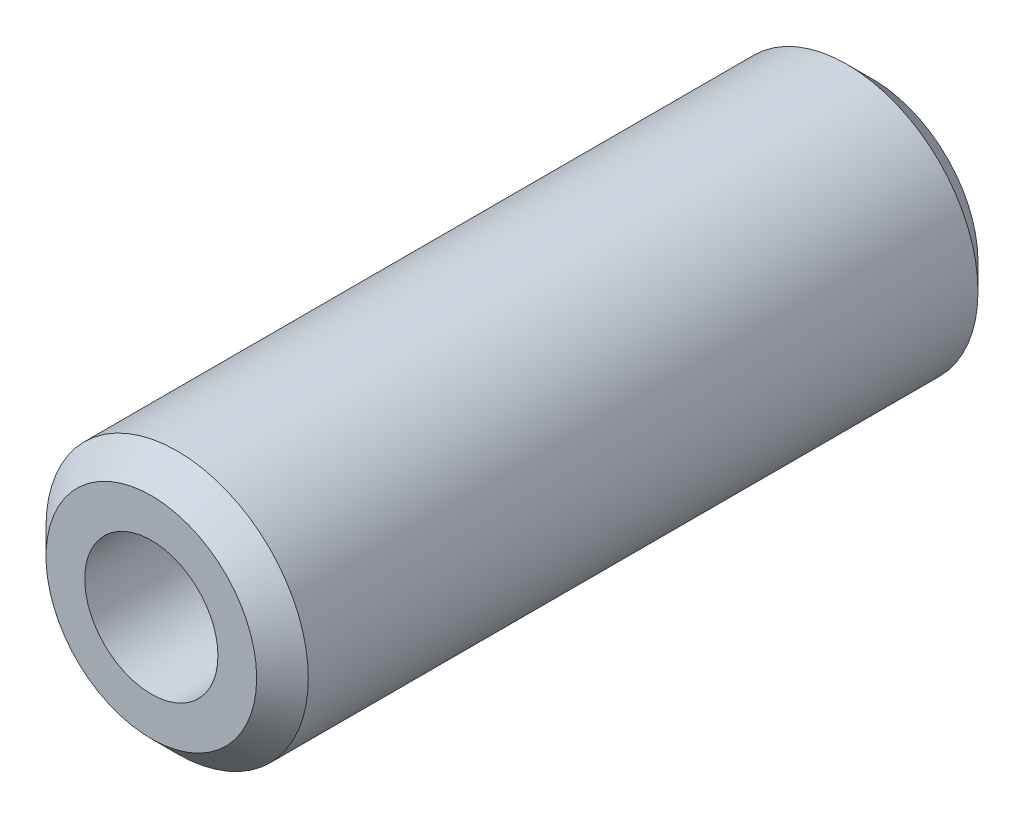
from build123d import *

# Parameters (mm, degrees)
SKETCH1_R               = 12.7
BOSS_EXTRUDE1_DEPTH     = 69.85
CUT_EXTRUDE1_DEPTH      = 73.122135992
CUT_EXTRUDE1_DEPTH_BACK = 73.122135992
SKETCH2_R               = 6.45
CHAMFER1_SIZE           = 2.5


with BuildPart() as part:
    # Sketch1 → Boss-Extrude1 (new body)
    with BuildSketch(Plane.XY):
        Circle(SKETCH1_R)
    extrude(amount=BOSS_EXTRUDE1_DEPTH)

    # Sketch2 → Cut-Extrude1 (cut, two sides: drawn at the far end of the back side and taken through both)
    with BuildSketch(Plane.XY.offset(69.85).offset(-CUT_EXTRUDE1_DEPTH_BACK)):
        Circle(SKETCH2_R)
    extrude(amount=CUT_EXTRUDE1_DEPTH + CUT_EXTRUDE1_DEPTH_BACK, mode=Mode.SUBTRACT)

    # Chamfer1
    chamfer1_edges = [part.edges().sort_by_distance(p)[0] for p in [
        (-12.7, 0, 0),
        (-12.7, 0, 69.85),
    ]]
    chamfer(chamfer1_edges, length=CHAMFER1_SIZE)


solid = part.part
